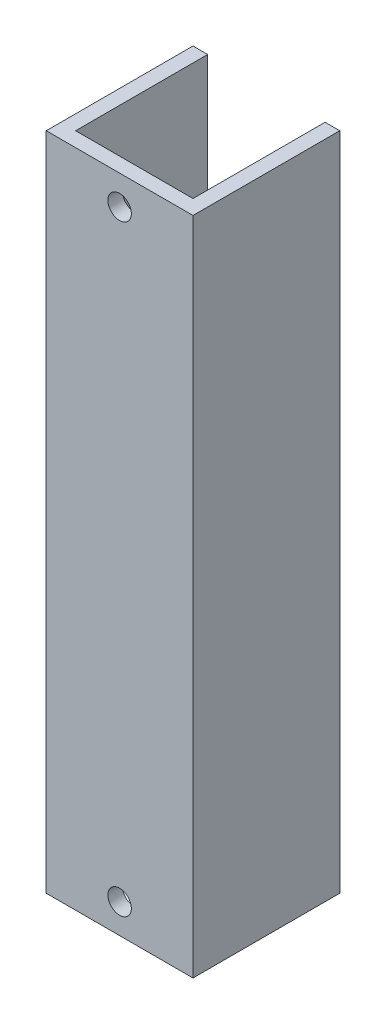
from build123d import *

# Parameters (mm, degrees)
BOSS_EXTRUDE1_DEPTH = 142.875
SKETCH3_R           = 2.54
CUT_EXTRUDE1_DEPTH  = 3.175


with BuildPart() as part:
    # Sketch1 → Boss-Extrude1 (new body)
    with BuildSketch(Plane(origin=(0, 0, 0), x_dir=(1, 0, 0), z_dir=(0, 1, 0))):
        Polygon((0, 0), (31.75, 0), (31.75, 31.75), (28.575, 31.75), (28.575, 3.175), (3.175, 3.175), (3.175, 31.75), (0, 31.75), align=None)
    extrude(amount=BOSS_EXTRUDE1_DEPTH)

    # Sketch3 → Cut-Extrude1 (cut)
    with BuildSketch(Plane(origin=(0, 0, -3.175), x_dir=(-1, 0, 0), z_dir=(0, 0, -1))):
        with Locations((-15.875, 6.35)):
            Circle(SKETCH3_R)
        with Locations((-15.875, 136.525)):
            Circle(SKETCH3_R)
    extrude(amount=-CUT_EXTRUDE1_DEPTH, mode=Mode.SUBTRACT)


solid = part.part
